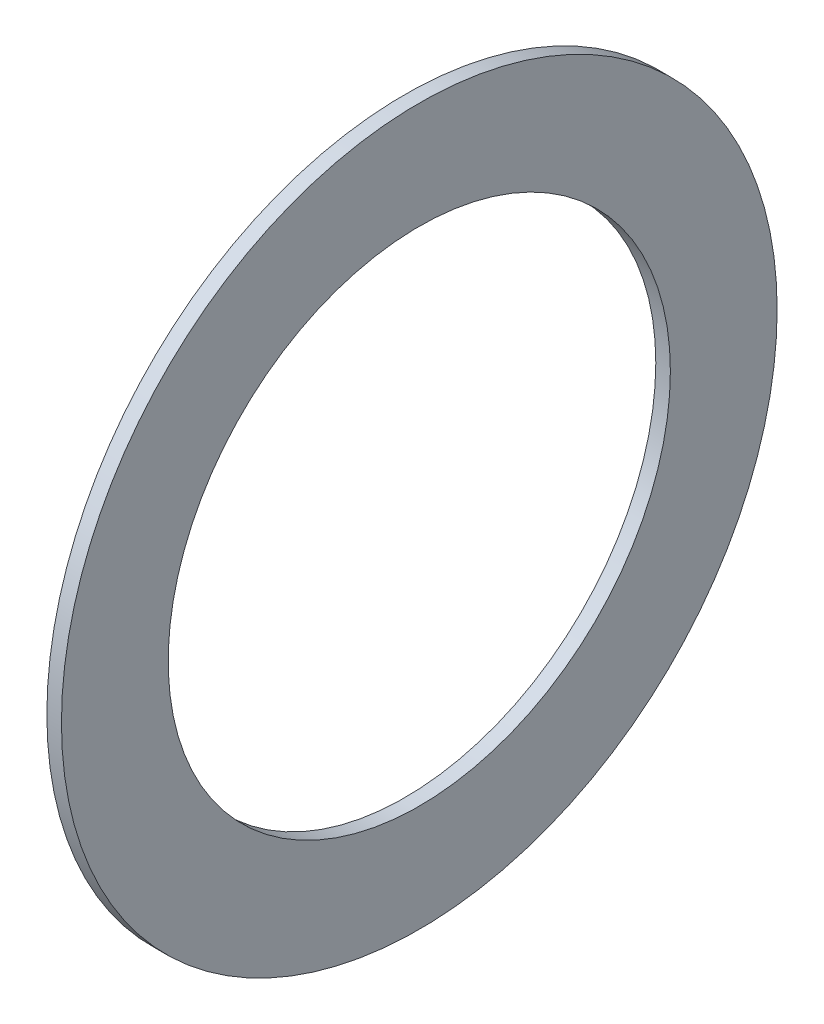
from build123d import *

# Parameters (mm, degrees)
ESQUISSE1_R        = 73.6092
ESQUISSE1_R_2      = 51.649
BOSS_EXTRU_1_DEPTH = 3


with BuildPart() as part:
    # Esquisse1 → Boss.-Extru.1 (new body)
    with BuildSketch(Plane(origin=(0, 0, 0), x_dir=(0, 0, -1), z_dir=(1, 0, 0))):
        Circle(ESQUISSE1_R)
        Circle(ESQUISSE1_R_2, mode=Mode.SUBTRACT)
    extrude(amount=BOSS_EXTRU_1_DEPTH)


solid = part.part
